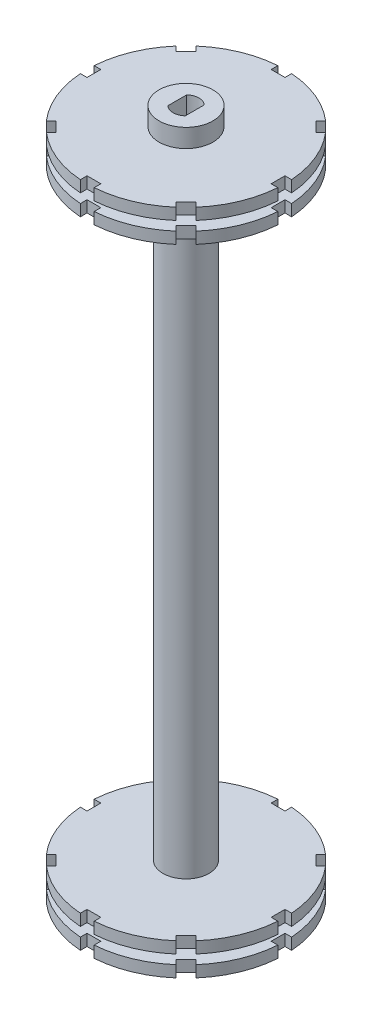
from build123d import *

# Parameters (mm, degrees)
BOSS_EXTRUDE1_DEPTH     = 6.5
SKETCH2_R               = 21.5
BOSS_EXTRUDE2_DEPTH     = 2.5
CUT_EXTRUDE1_DEPTH      = 8
SKETCH4_W               = 3
SKETCH4_H               = 3
CUT_EXTRUDE2_DEPTH      = 10
SKETCH5_R               = 5
BOSS_EXTRUDE3_DEPTH     = 140
CUT_EXTRUDE3_DEPTH      = 15
MIRROR6_COPY_1_SKETCH_R = 21.5
MIRROR6_COPY_1_DEPTH    = 2.5
MIRROR6_COPY_2_SKETCH_W = 3
MIRROR6_COPY_2_SKETCH_H = 3
MIRROR6_COPY_2_DEPTH    = 10


with BuildPart() as part:
    # Sketch1 → Boss-Extrude1 (new body)
    with BuildSketch(Plane(origin=(0, 0, 0), x_dir=(1, 0, 0), z_dir=(0, 1, 0))):
        with BuildLine():
            ThreePointArc((-1.9, -2.05669638), (-2.8, 0), (-1.9, 2.05669638))
            Line((-1.9, 2.05669638), (-1.9, 5.532856405))
            ThreePointArc((-1.9, 5.532856405), (-5.85, 0), (-1.9, -5.532856405))
            Line((-1.9, -5.532856405), (-1.9, -2.05669638))
        make_face()
        with BuildLine():
            ThreePointArc((-1.9, 2.05669638), (0, 2.8), (1.9, 2.05669638))
            Line((1.9, 2.05669638), (1.9, 5.532856405))
            ThreePointArc((1.9, 5.532856405), (0, 5.85), (-1.9, 5.532856405))
            Line((-1.9, 5.532856405), (-1.9, 2.05669638))
        make_face()
        with BuildLine():
            Line((1.9, 5.532856405), (1.9, 2.05669638))
            ThreePointArc((1.9, 2.05669638), (2.565151068, 1.122497216), (2.8, 0))
            ThreePointArc((2.8, 0), (2.565151068, -1.122497216), (1.9, -2.05669638))
            Line((1.9, -2.05669638), (1.9, -5.532856405))
            ThreePointArc((1.9, -5.532856405), (4.761171074, -3.399080758), (5.85, 0))
            ThreePointArc((5.85, 0), (4.761171074, 3.399080758), (1.9, 5.532856405))
        make_face()
        with BuildLine():
            Line((1.9, -5.532856405), (1.9, -2.05669638))
            ThreePointArc((1.9, -2.05669638), (0, -2.8), (-1.9, -2.05669638))
            Line((-1.9, -2.05669638), (-1.9, -5.532856405))
            ThreePointArc((-1.9, -5.532856405), (0, -5.85), (1.9, -5.532856405))
        make_face()
        with BuildLine():
            Line((-1.9, -2.05669638), (-1.9, 2.05669638))
            ThreePointArc((-1.9, 2.05669638), (-2.8, 0), (-1.9, -2.05669638))
        make_face()
        with BuildLine():
            ThreePointArc((2.8, 0), (2.565151068, 1.122497216), (1.9, 2.05669638))
            Line((1.9, 2.05669638), (1.9, -2.05669638))
            ThreePointArc((1.9, -2.05669638), (2.565151068, -1.122497216), (2.8, 0))
        make_face()
    boss_extrude1 = extrude(amount=BOSS_EXTRUDE1_DEPTH)

    # Sketch2 → Boss-Extrude2 (add)
    with BuildSketch(Plane(origin=(0, 6.5, 0), x_dir=(1, 0, 0), z_dir=(0, 1, 0))):
        with Locations(Location((0, 0, 0), (0, 0, 270))):
            Circle(SKETCH2_R)
    boss_extrude2 = extrude(amount=-BOSS_EXTRUDE2_DEPTH)

    # Sketch3 → Cut-Extrude1 (cut)
    with BuildSketch(Plane.XZ.offset(-4)):
        with BuildLine():
            Line((-1.9, 2.05669638), (-1.9, -2.05669638))
            ThreePointArc((-1.9, -2.05669638), (0, -2.8), (1.9, -2.05669638))
            Line((1.9, -2.05669638), (1.9, 2.05669638))
            ThreePointArc((1.9, 2.05669638), (0, 2.8), (-1.9, 2.05669638))
        make_face()
    cut_extrude1 = extrude(amount=-CUT_EXTRUDE1_DEPTH, mode=Mode.SUBTRACT)

    # Sketch4 → Cut-Extrude2 (cut)
    with BuildSketch(Plane(origin=(0, 6.5, 0), x_dir=(1, 0, 0), z_dir=(0, 1, 0))):
        Polygon((15.202795796, -13.081475452), (17.324116139, -15.202795796), (15.202795796, -17.324116139), (13.081475452, -15.202795796), align=None)
        with Locations((21.5, 0)):
            Rectangle(SKETCH4_W, SKETCH4_H)
        with Locations((0, -21.5)):
            Rectangle(SKETCH4_W, SKETCH4_H)
        Polygon((-13.081475452, -15.202795796), (-15.202795796, -17.324116139), (-17.324116139, -15.202795796), (-15.202795796, -13.081475452), align=None)
        with Locations((-21.5, 0)):
            Rectangle(SKETCH4_W, SKETCH4_H)
        Polygon((-15.202795796, 13.081475452), (-17.324116139, 15.202795796), (-15.202795796, 17.324116139), (-13.081475452, 15.202795796), align=None)
        with Locations((0, 21.5)):
            Rectangle(SKETCH4_W, SKETCH4_H)
        Polygon((13.081475452, 15.202795796), (15.202795796, 17.324116139), (17.324116139, 15.202795796), (15.202795796, 13.081475452), align=None)
    cut_extrude2 = extrude(amount=-CUT_EXTRUDE2_DEPTH, mode=Mode.SUBTRACT)

    # Sketch5 → Boss-Extrude3 (add)
    with BuildSketch(Plane(origin=(0, 6.5, 0), x_dir=(1, 0, 0), z_dir=(0, 1, 0))):
        with Locations(Location((0, 0, 0), (0, 0, 270))):
            Circle(SKETCH5_R)
    extrude(amount=BOSS_EXTRUDE3_DEPTH)

    # Mirror1: Boss-Extrude2 across plane
    add(boss_extrude2.mirror(Plane.ZX.offset(76.5)))

    # Mirror2: Boss-Extrude1 across plane
    add(boss_extrude1.mirror(Plane.ZX.offset(76.5)))

    # Mirror3: Boss-Extrude2, Cut-Extrude1, Cut-Extrude2 across plane
    add(boss_extrude2.mirror(Plane.ZX.offset(7.5)))
    add(cut_extrude1.mirror(Plane.ZX.offset(7.5)), mode=Mode.SUBTRACT)
    add(cut_extrude2.mirror(Plane.ZX.offset(7.5)), mode=Mode.SUBTRACT)

    # Sketch6 → Cut-Extrude3 (cut)
    with BuildSketch(Plane.XZ.offset(-11)):
        with BuildLine():
            Line((-1.9, 2.05669638), (-1.9, -2.05669638))
            ThreePointArc((-1.9, -2.05669638), (0, -2.8), (1.9, -2.05669638))
            Line((1.9, -2.05669638), (1.9, 2.05669638))
            ThreePointArc((1.9, 2.05669638), (0, 2.8), (-1.9, 2.05669638))
        make_face()
    extrude(amount=-CUT_EXTRUDE3_DEPTH, mode=Mode.SUBTRACT)

    # Mirror5: Cut-Extrude2 across plane
    add(cut_extrude2.mirror(Plane.ZX.offset(76.5)), mode=Mode.SUBTRACT)

    # Mirror6 copy 1 sketch → Mirror6 copy 1 (add)
    with BuildSketch(Plane(origin=(0, 144.5, 0), x_dir=(1, 0, 0), z_dir=(0, 1, 0))):
        with Locations(Location((0, 0, 0), (0, 0, 270))):
            Circle(MIRROR6_COPY_1_SKETCH_R)
    extrude(amount=-MIRROR6_COPY_1_DEPTH)

    # Mirror6 copy 2 sketch → Mirror6 copy 2 (cut)
    with BuildSketch(Plane(origin=(0, 144.5, 0), x_dir=(1, 0, 0), z_dir=(0, 1, 0))):
        Polygon((15.202795796, -13.081475452), (17.324116139, -15.202795796), (15.202795796, -17.324116139), (13.081475452, -15.202795796), align=None)
        with Locations((21.5, 0)):
            Rectangle(MIRROR6_COPY_2_SKETCH_W, MIRROR6_COPY_2_SKETCH_H)
        with Locations((0, -21.5)):
            Rectangle(MIRROR6_COPY_2_SKETCH_W, MIRROR6_COPY_2_SKETCH_H)
        Polygon((-13.081475452, -15.202795796), (-15.202795796, -17.324116139), (-17.324116139, -15.202795796), (-15.202795796, -13.081475452), align=None)
        with Locations((-21.5, 0)):
            Rectangle(MIRROR6_COPY_2_SKETCH_W, MIRROR6_COPY_2_SKETCH_H)
        Polygon((-15.202795796, 13.081475452), (-17.324116139, 15.202795796), (-15.202795796, 17.324116139), (-13.081475452, 15.202795796), align=None)
        with Locations((0, 21.5)):
            Rectangle(MIRROR6_COPY_2_SKETCH_W, MIRROR6_COPY_2_SKETCH_H)
        Polygon((13.081475452, 15.202795796), (15.202795796, 17.324116139), (17.324116139, 15.202795796), (15.202795796, 13.081475452), align=None)
    extrude(amount=-MIRROR6_COPY_2_DEPTH, mode=Mode.SUBTRACT)


solid = part.part
